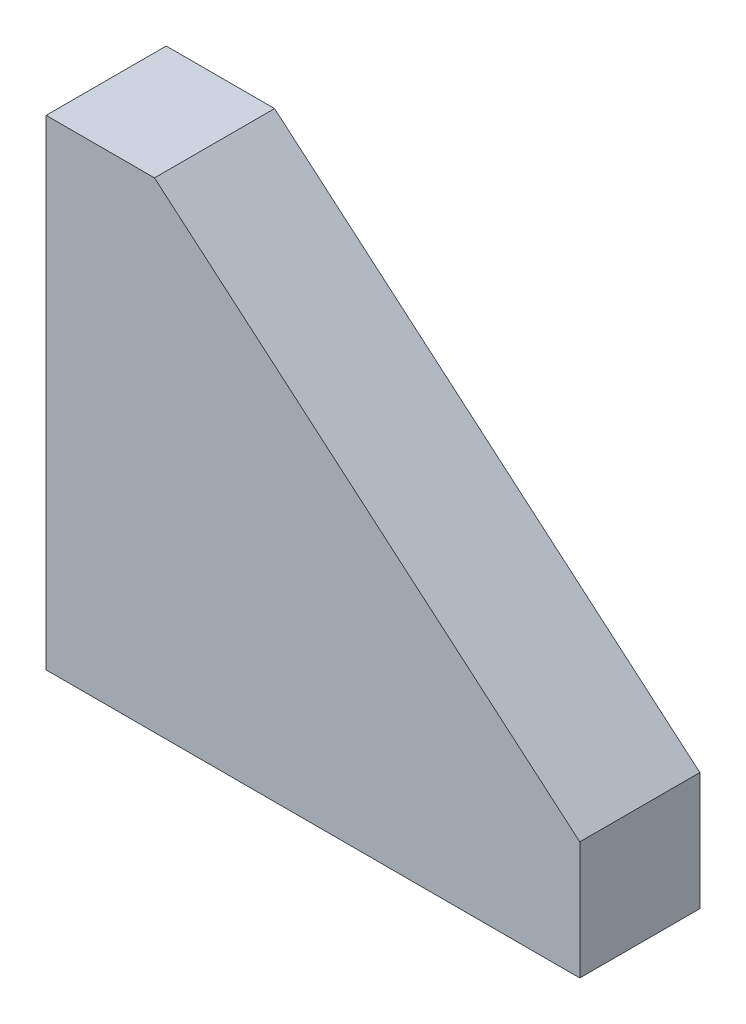
from build123d import *

# Parameters (mm, degrees)
SKETCH1_W           = 25.4
SKETCH1_H           = 22.86
BOSS_EXTRUDE1_DEPTH = 5.715
CUT_EXTRUDE1_REACH  = 36.647


with BuildPart() as part:
    # Sketch1 → Boss-Extrude1 (new body)
    with BuildSketch(Plane.XY):
        with Locations((12.7, 11.43)):
            Rectangle(SKETCH1_W, SKETCH1_H)
    extrude(amount=BOSS_EXTRUDE1_DEPTH)

    # Sketch2 → Cut-Extrude1 (cut, up to next)
    with BuildSketch(Plane.XY.offset(5.715), mode=Mode.PRIVATE) as cut_extrude1_sk1:
        Polygon((5.15716279, 22.86), (25.4, 5.612386194), (25.4, 22.86), align=None)
    cut_extrude1_tool1 = extrude(cut_extrude1_sk1.sketch, amount=-CUT_EXTRUDE1_REACH, mode=Mode.PRIVATE) & part.part
    add(cut_extrude1_tool1.solids().sort_by_distance((18.652388, 17.110795, 5.715))[0], mode=Mode.SUBTRACT)


solid = part.part
